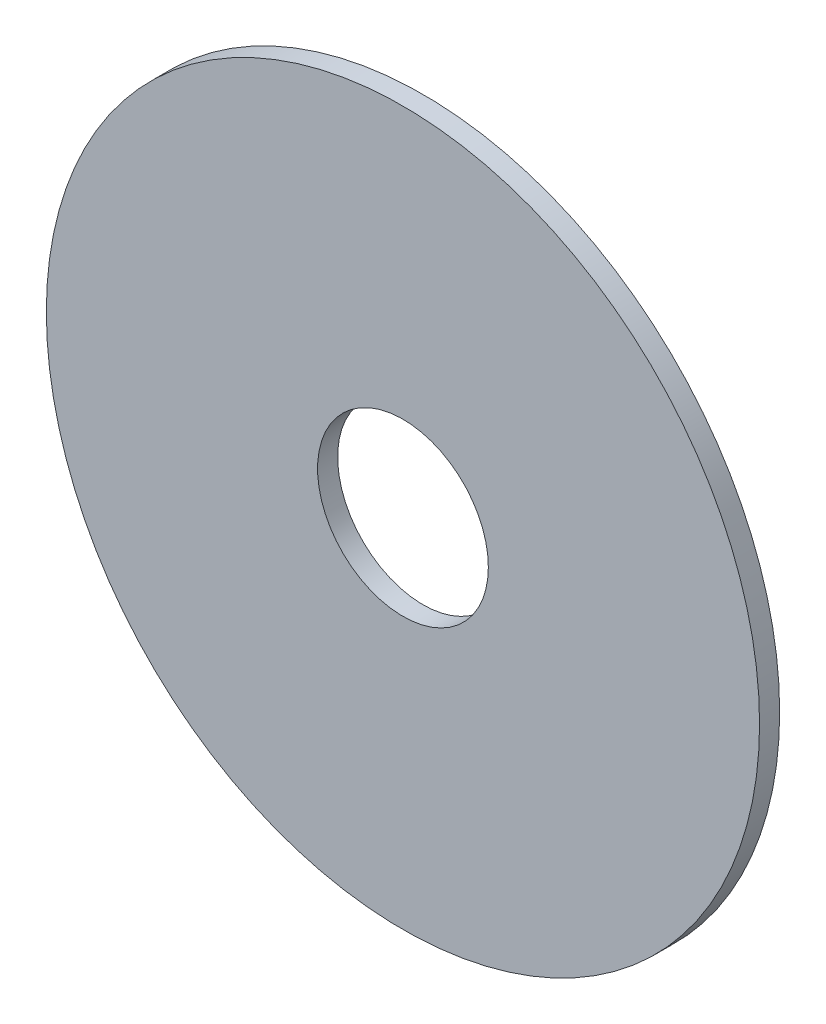
from build123d import *

# Parameters (mm, degrees)
CROQUIS6_R              = 177.5
CROQUIS6_R_2            = 42.5
SALIENTE_EXTRUIR1_DEPTH = 10


with BuildPart() as part:
    # Croquis6 → Saliente-Extruir1 (new body)
    with BuildSketch(Plane.XY):
        Circle(CROQUIS6_R)
        Circle(CROQUIS6_R_2, mode=Mode.SUBTRACT)
    extrude(amount=SALIENTE_EXTRUIR1_DEPTH)


solid = part.part
